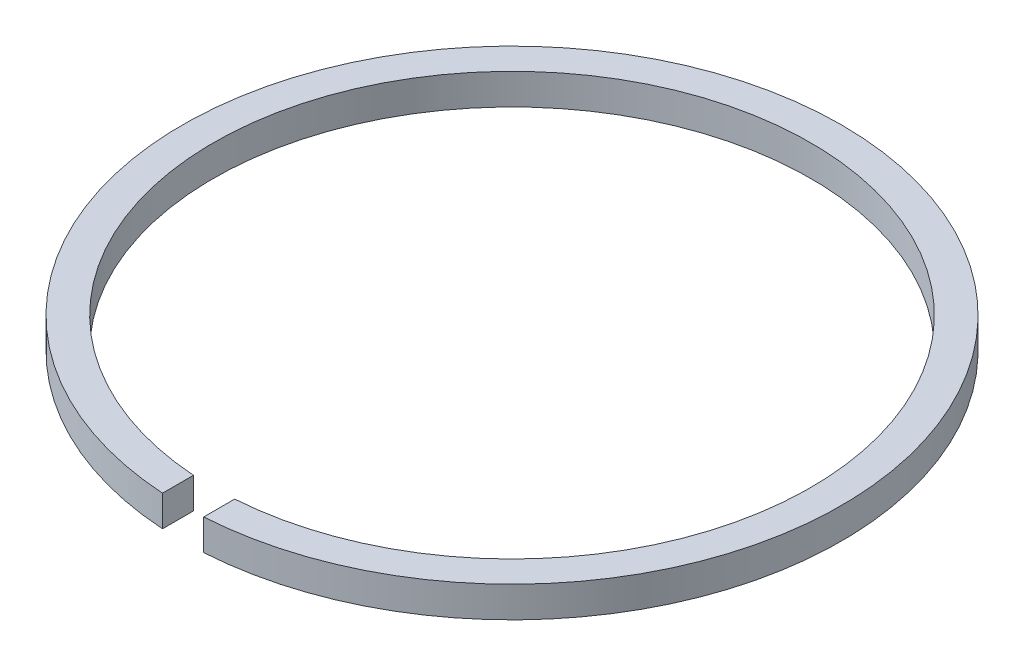
from build123d import *

# Parameters (mm, degrees)
BOSS_EXTRUDE1_DEPTH = 0.75


with BuildPart() as part:
    # Sketch1 → Boss-Extrude1 (new, symmetric)
    with BuildSketch(Plane(origin=(0, 0, 0), x_dir=(1, 0, 0), z_dir=(0, 1, 0))):
        with BuildLine():
            Line((-1, -15.968719423), (-1, -14.465476141))
            ThreePointArc((-1, -14.465476141), (-9.893179469, 10.600707524), (14.5, 0))
            ThreePointArc((14.5, 0), (10.600707524, -9.893179469), (1, -14.465476141))
            Line((1, -14.465476141), (1, -15.968719423))
            ThreePointArc((1, -15.968719423), (11.66190379, -10.95445115), (16, 0))
            ThreePointArc((16, 0), (-10.95445115, 11.66190379), (-1, -15.968719423))
        make_face()
    extrude(amount=BOSS_EXTRUDE1_DEPTH, both=True)


solid = part.part
